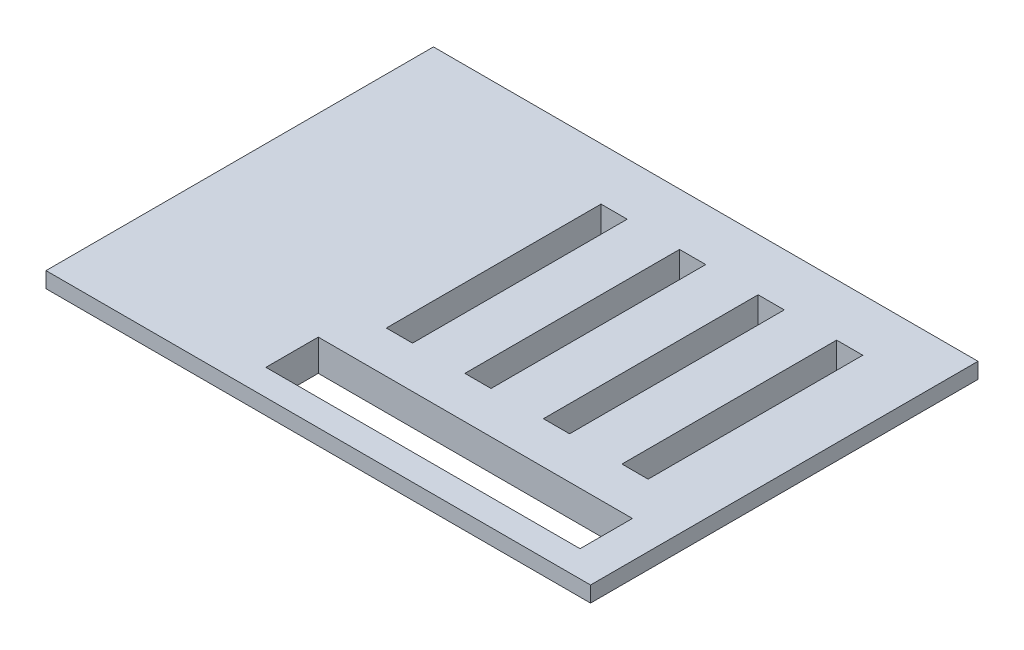
from build123d import *

# Parameters (mm, degrees)
BOSS_EXTRUDE1_DEPTH      = 3
BOSS_EXTRUDE1_DEPTH_BACK = 3
SKETCH1_W                = 90
SKETCH1_H                = 64
SKETCH1_4_W              = 104
SKETCH1_4_H              = 74
SKETCH1_4_W_2            = 90
SKETCH1_4_H_2            = 64
BOSS_EXTRUDE3_DEPTH      = 3
CUT_EXTRUDE1_DEPTH       = 120.18892566
CUT_EXTRUDE1_DEPTH_BACK  = 120.18892566
SKETCH2_W                = 60
SKETCH2_H                = 10
SKETCH3_W                = 5
SKETCH3_H                = 41
CUT_EXTRUDE2_DEPTH       = 120.18892566


with BuildPart() as part:
    # Sketch1 → Boss-Extrude1 (new, two sides: drawn at the far end of the back side and taken through both)
    with BuildSketch(Plane(origin=(0, 0, 0), x_dir=(1, 0, 0), z_dir=(0, 1, 0)).offset(-BOSS_EXTRUDE1_DEPTH_BACK)):
        with Locations((45, 32)):
            Rectangle(SKETCH1_W, SKETCH1_H)
    extrude(amount=BOSS_EXTRUDE1_DEPTH + BOSS_EXTRUDE1_DEPTH_BACK)

    # Sketch1<4> → Boss-Extrude3 (add)
    with BuildSketch(Plane(origin=(0, 0, 0), x_dir=(1, 0, 0), z_dir=(0, 1, 0))):
        with Locations((45, 32)):
            Rectangle(SKETCH1_4_W, SKETCH1_4_H)
        with Locations((45, 32)):
            Rectangle(SKETCH1_4_W_2, SKETCH1_4_H_2, mode=Mode.SUBTRACT)
    extrude(amount=BOSS_EXTRUDE3_DEPTH)

    # Sketch2 → Cut-Extrude1 (cut, two sides: drawn at the far end of the back side and taken through both)
    with BuildSketch(Plane.XZ.offset(3).offset(-CUT_EXTRUDE1_DEPTH_BACK)):
        with Locations((60, -5)):
            Rectangle(SKETCH2_W, SKETCH2_H)
    extrude(amount=CUT_EXTRUDE1_DEPTH + CUT_EXTRUDE1_DEPTH_BACK, mode=Mode.SUBTRACT)

    # Sketch3 → Cut-Extrude2 (cut, through all)
    with BuildSketch(Plane(origin=(0, 3, 0), x_dir=(1, 0, 0), z_dir=(0, 1, 0))):
        with Locations((37.5, 38.5)):
            Rectangle(SKETCH3_W, SKETCH3_H)
        with Locations((52.5, 38.5)):
            Rectangle(SKETCH3_W, SKETCH3_H)
        with Locations((82.5, 38.5)):
            Rectangle(SKETCH3_W, SKETCH3_H)
        with Locations((67.5, 38.5)):
            Rectangle(SKETCH3_W, SKETCH3_H)
    extrude(amount=-CUT_EXTRUDE2_DEPTH, mode=Mode.SUBTRACT)


solid = part.part
